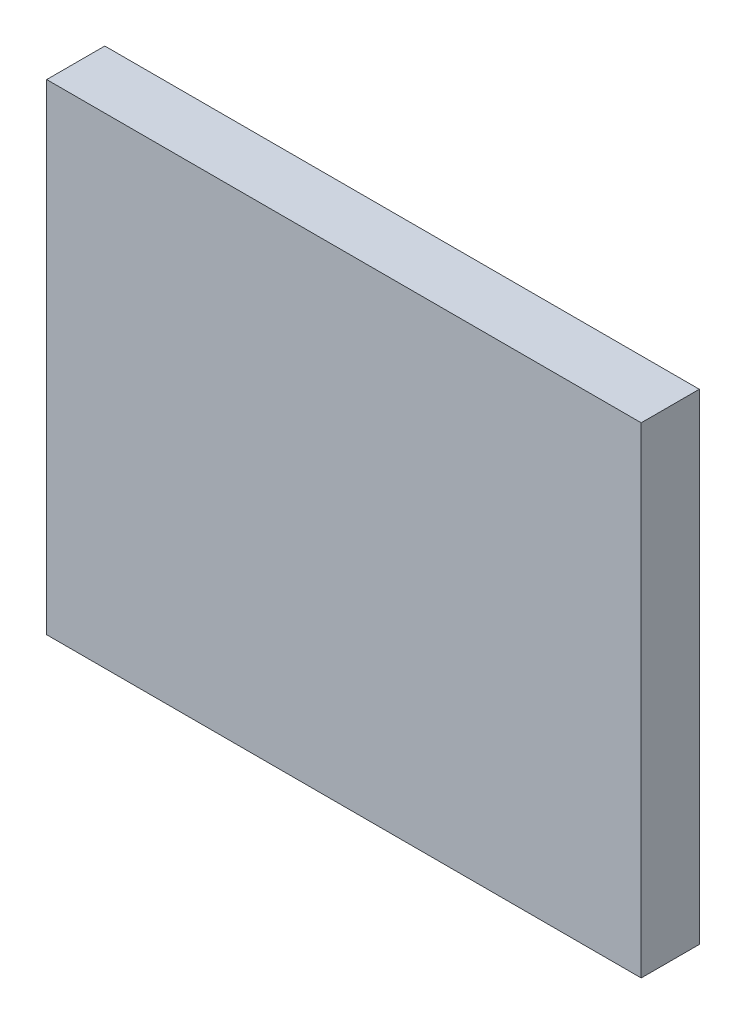
from build123d import *

# Parameters (mm, degrees)
SKETCH_1_W      = 102.319662563
SKETCH_1_H      = 82.75327095
EXTRUDE_1_DEPTH = 10


with BuildPart() as part:
    # 草图1 → 凸台-拉伸1 (new body)
    with BuildSketch(Plane.XY):
        with Locations((-25.938932001, -3.769671779)):
            Rectangle(SKETCH_1_W, SKETCH_1_H)
    extrude(amount=EXTRUDE_1_DEPTH)


solid = part.part
